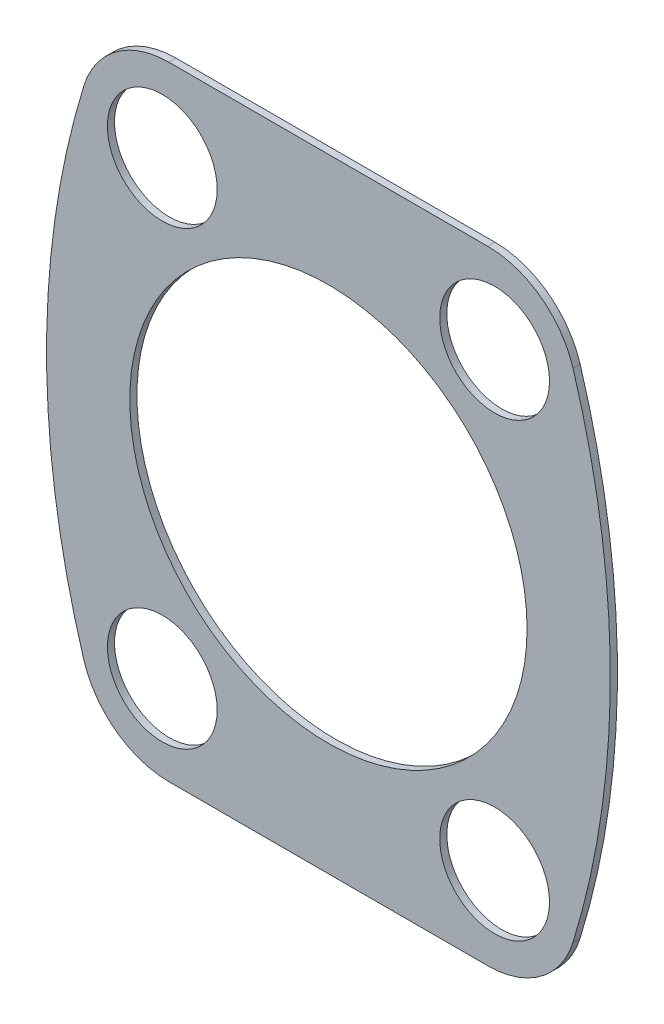
from build123d import *

# Parameters (mm, degrees)
SKETCH1_R      = 9.25
SKETCH1_R_2    = 33.475
EXTRUDE2_DEPTH = 1.2


with BuildPart() as part:
    # Sketch1 → Extrude2 (new body)
    with BuildSketch(Plane.XY):
        with BuildLine():
            Line((-26.875, -52.5), (26.875, -52.5))
            ThreePointArc((26.875, -52.5), (35.790865916, -49.562642122), (41.214853301, -41.900977995))
            ThreePointArc((41.214853301, -41.900977995), (47.5, 0), (41.214853301, 41.900977995))
            ThreePointArc((41.214853301, 41.900977995), (35.790865916, 49.562642122), (26.875, 52.5))
            Line((26.875, 52.5), (-26.875, 52.5))
            ThreePointArc((-26.875, 52.5), (-35.790865916, 49.562642122), (-41.214853301, 41.900977995))
            ThreePointArc((-41.214853301, 41.900977995), (-47.5, 0), (-41.214853301, -41.900977995))
            ThreePointArc((-41.214853301, -41.900977995), (-35.790865916, -49.562642122), (-26.875, -52.5))
        make_face()
        with Locations((-28, -38)):
            Circle(SKETCH1_R, mode=Mode.SUBTRACT)
        with Locations((28, -38)):
            Circle(SKETCH1_R, mode=Mode.SUBTRACT)
        with Locations((28, 38)):
            Circle(SKETCH1_R, mode=Mode.SUBTRACT)
        with Locations((-28, 38)):
            Circle(SKETCH1_R, mode=Mode.SUBTRACT)
        Circle(SKETCH1_R_2, mode=Mode.SUBTRACT)
    extrude(amount=EXTRUDE2_DEPTH)


solid = part.part
